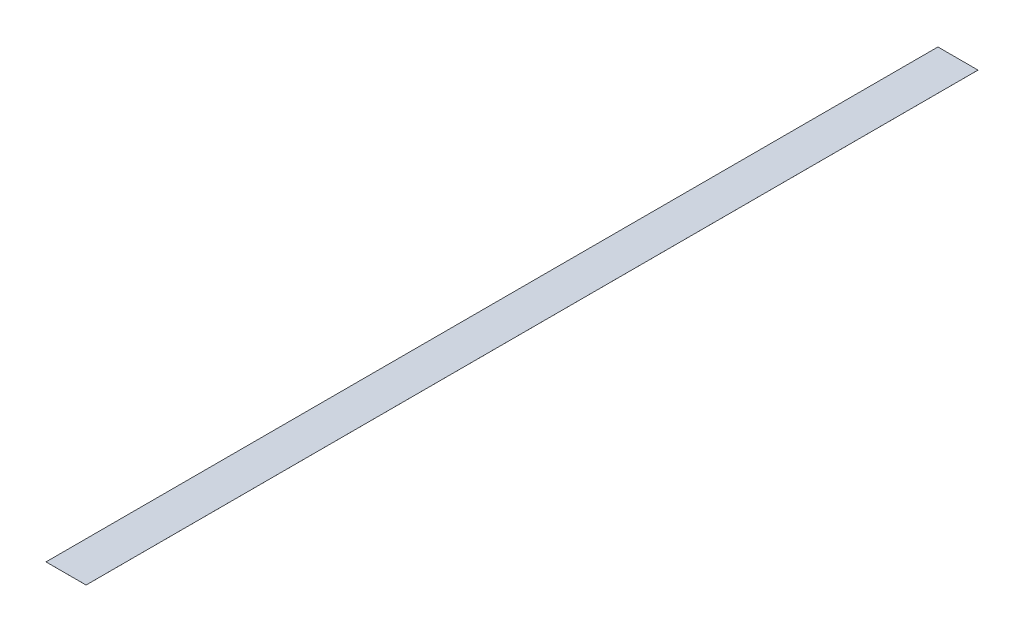
from build123d import *

# Parameters (mm, degrees)
ESBO_O1_W                = 18.934391234
ESBO_O1_H                = 421.330154147
RESSALTO_EXTRUS_O7_DEPTH = 0.01


with BuildPart() as part:
    # Esboço1 → Ressalto-extrusão7 (new body)
    with BuildSketch(Plane(origin=(0, 0, 0), x_dir=(1, 0, 0), z_dir=(0, 1, 0))):
        with Locations((443.89137453, 893.066340774)):
            Rectangle(ESBO_O1_W, ESBO_O1_H)
    extrude(amount=RESSALTO_EXTRUS_O7_DEPTH)


solid = part.part
